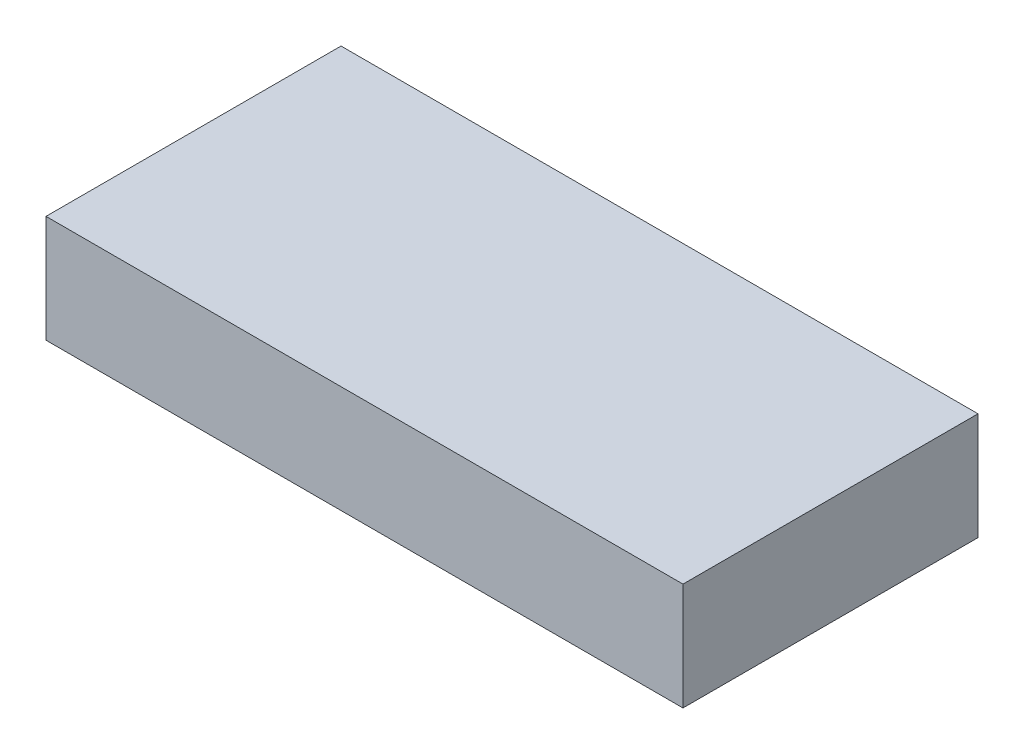
from build123d import *

# Parameters (mm, degrees)
SKETCH_1_W      = 95
SKETCH_1_H      = 44
EXTRUDE_1_DEPTH = 16


with BuildPart() as part:
    # 스케치1 → 보스-돌출1 (new body)
    with BuildSketch(Plane(origin=(0, 0, 0), x_dir=(1, 0, 0), z_dir=(0, 1, 0))):
        Rectangle(SKETCH_1_W, SKETCH_1_H)
    extrude(amount=EXTRUDE_1_DEPTH)


solid = part.part
